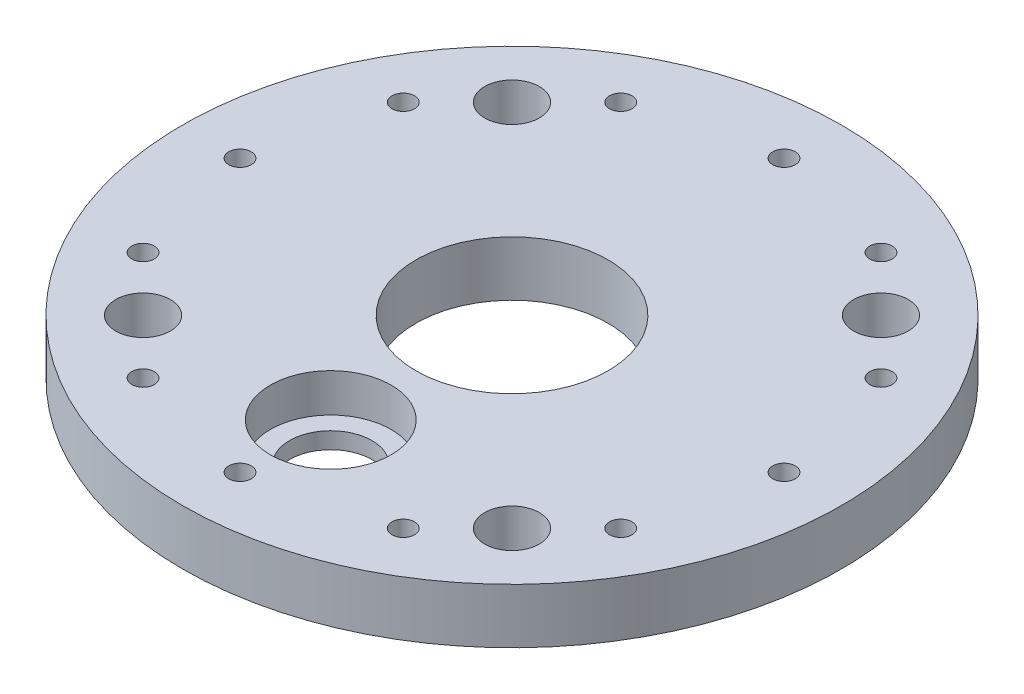
from build123d import *

# Parameters (mm, degrees)
SKETCH1_R           = 60
BOSS_EXTRUDE1_DEPTH = 10
SKETCH2_R           = 11
CUT_EXTRUDE1_DEPTH  = 7
SKETCH3_R           = 7.5
CUT_EXTRUDE2_DEPTH  = 86.141059425
SKETCH5_R           = 4.975
SKETCH5_R_2         = 2.05
CUT_EXTRUDE4_DEPTH  = 86.440037453
SKETCH6_R           = 2.05
CUT_EXTRUDE5_DEPTH  = 86.440037453
CIRPATTERN1_COUNT   = 4
SKETCH7_R           = 17.5
CUT_EXTRUDE6_DEPTH  = 86.440037453


with BuildPart() as part:
    # Sketch1 → Boss-Extrude1 (new body)
    with BuildSketch(Plane(origin=(0, 0, 0), x_dir=(1, 0, 0), z_dir=(0, 1, 0))):
        with Locations(Location((0, 0, 0), (0, 0, 270))):
            Circle(SKETCH1_R)
    extrude(amount=BOSS_EXTRUDE1_DEPTH)

    # Sketch2 → Cut-Extrude1 (cut)
    with BuildSketch(Plane(origin=(0, 10, 0), x_dir=(1, 0, 0), z_dir=(0, 1, 0))):
        with Locations(Location((0, -33, 0), (0, 0, 270))):
            Circle(SKETCH2_R)
    extrude(amount=-CUT_EXTRUDE1_DEPTH, mode=Mode.SUBTRACT)

    # Sketch3 → Cut-Extrude2 (cut, through all)
    with BuildSketch(Plane(origin=(0, 3, 0), x_dir=(1, 0, 0), z_dir=(0, 1, 0))):
        with Locations(Location((0, -33, 0), (0, 0, 270))):
            Circle(SKETCH3_R)
    extrude(amount=-CUT_EXTRUDE2_DEPTH, mode=Mode.SUBTRACT)

    # Sketch5 → Cut-Extrude4 (cut, through all)
    with BuildSketch(Plane(origin=(0, 10, 0), x_dir=(1, 0, 0), z_dir=(0, 1, 0))):
        with Locations(Location((-33.587572106, -33.587572106, 0), (0, 0, 270))):
            Circle(SKETCH5_R)
        with Locations(Location((-43.487067043, -23.68807717, 0), (0, 0, 270))):
            Circle(SKETCH5_R_2)
        with Locations(Location((-23.68807717, -43.487067043, 0), (0, 0, 270))):
            Circle(SKETCH5_R_2)
    cut_extrude4 = extrude(amount=-CUT_EXTRUDE4_DEPTH, mode=Mode.SUBTRACT)

    # Sketch6 → Cut-Extrude5 (cut, through all)
    with BuildSketch(Plane(origin=(0, 10, 0), x_dir=(1, 0, 0), z_dir=(0, 1, 0))):
        with Locations(Location((0, -49.52, 0), (0, 0, 270))):
            Circle(SKETCH6_R)
    cut_extrude5 = extrude(amount=-CUT_EXTRUDE5_DEPTH, mode=Mode.SUBTRACT)

    # CirPattern1: Cut-Extrude4, Cut-Extrude5 ×4 about axis
    cirpattern1_axis = Axis((0, 0, 0), (0, 1, 0))
    add([cut_extrude4.rotate(cirpattern1_axis, i * 360 / CIRPATTERN1_COUNT) for i in range(1, CIRPATTERN1_COUNT)], mode=Mode.SUBTRACT)
    add([cut_extrude5.rotate(cirpattern1_axis, i * 360 / CIRPATTERN1_COUNT) for i in range(1, CIRPATTERN1_COUNT)], mode=Mode.SUBTRACT)

    # Sketch7 → Cut-Extrude6 (cut, through all)
    with BuildSketch(Plane(origin=(0, 10, 0), x_dir=(1, 0, 0), z_dir=(0, 1, 0))):
        with Locations(Location((0, 0, 0), (0, 0, 270))):
            Circle(SKETCH7_R)
    extrude(amount=-CUT_EXTRUDE6_DEPTH, mode=Mode.SUBTRACT)


solid = part.part
